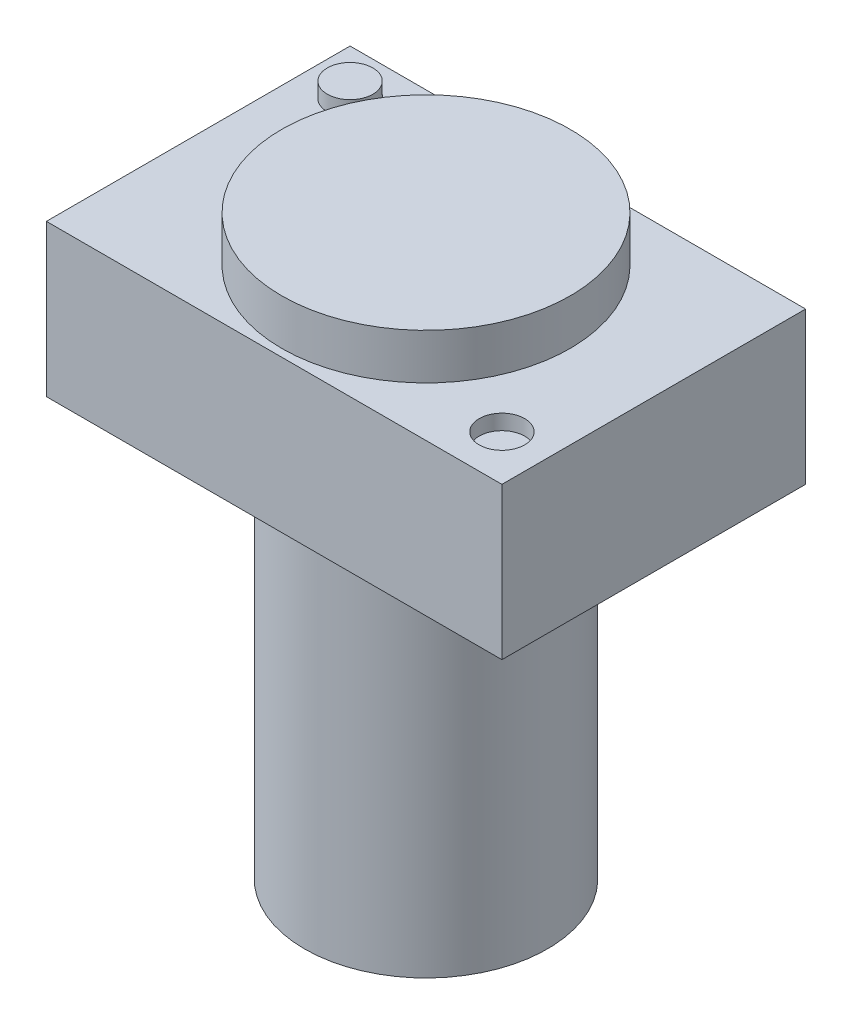
from build123d import *

# Parameters (mm, degrees)
SKETCH1_W           = 30
SKETCH1_H           = 20
BOSS_EXTRUDE1_DEPTH = 10
SKETCH2_R           = 8
BOSS_EXTRUDE2_DEPTH = 25
SKETCH3_R           = 9.5
BOSS_EXTRUDE3_DEPTH = 3
SKETCH4_R           = 1.5
BOSS_EXTRUDE4_DEPTH = 1
SKETCH5_R           = 1.5
CUT_EXTRUDE1_DEPTH  = 1


with BuildPart() as part:
    # Sketch1 → Boss-Extrude1 (new body)
    with BuildSketch(Plane(origin=(0, 0, 0), x_dir=(1, 0, 0), z_dir=(0, 1, 0))):
        with Locations((15, 10)):
            Rectangle(SKETCH1_W, SKETCH1_H)
    extrude(amount=-BOSS_EXTRUDE1_DEPTH)

    # Sketch2 → Boss-Extrude2 (add)
    with BuildSketch(Plane.XZ.offset(10)):
        with Locations(Location((15, -10, 0), (0, 0, 270))):
            Circle(SKETCH2_R)
    extrude(amount=BOSS_EXTRUDE2_DEPTH)

    # Sketch3 → Boss-Extrude3 (add)
    with BuildSketch(Plane(origin=(0, 0, 0), x_dir=(1, 0, 0), z_dir=(0, 1, 0))):
        with Locations(Location((15, 10, 0), (0, 0, 270))):
            Circle(SKETCH3_R)
    extrude(amount=BOSS_EXTRUDE3_DEPTH)

    # Sketch4 → Boss-Extrude4 (add)
    with BuildSketch(Plane(origin=(0, 0, 0), x_dir=(1, 0, 0), z_dir=(0, 1, 0))):
        with Locations(Location((3, 17, 0), (0, 0, 90))):
            Circle(SKETCH4_R)
    extrude(amount=BOSS_EXTRUDE4_DEPTH)

    # Sketch5 → Cut-Extrude1 (cut)
    with BuildSketch(Plane(origin=(0, 0, 0), x_dir=(1, 0, 0), z_dir=(0, 1, 0))):
        with Locations(Location((27, 3, 0), (0, 0, 270))):
            Circle(SKETCH5_R)
    extrude(amount=-CUT_EXTRUDE1_DEPTH, mode=Mode.SUBTRACT)


solid = part.part
